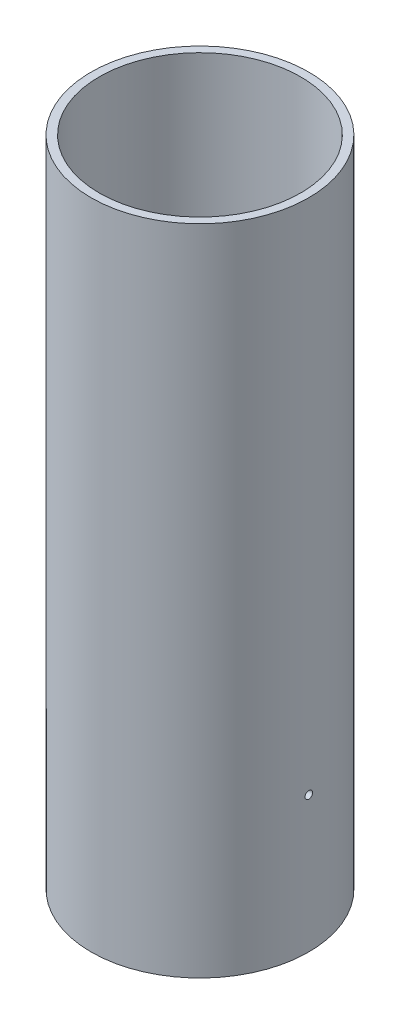
from build123d import *

# Parameters (mm, degrees)
SKETCH1_R               = 50.8
SKETCH1_R_2             = 46.99
BOSS_EXTRUDE1_DEPTH     = 304.8
CUT_EXTRUDE1_REACH      = 327.279
CUT_EXTRUDE1_END_RADIUS = 46.99
SKETCH2_R               = 1.7526
CIRPATTERN1_COUNT       = 2


with BuildPart() as part:
    # Sketch1 → Boss-Extrude1 (new body)
    with BuildSketch(Plane(origin=(0, 0, 0), x_dir=(1, 0, 0), z_dir=(0, 1, 0))):
        with Locations(Location((0, 0, 0), (0, 0, 90))):
            Circle(SKETCH1_R)
        with Locations(Location((0, 0, 0), (0, 0, 90))):
            Circle(SKETCH1_R_2, mode=Mode.SUBTRACT)
    extrude(amount=BOSS_EXTRUDE1_DEPTH)

    # Cut-Extrude1: up to this cylinder (the profile starts outside it)
    cut_extrude1_end = Plane(origin=(0, 63.5, 0), z_dir=(0, -1, 0)) * Cylinder(CUT_EXTRUDE1_END_RADIUS, 749.538, mode=Mode.PRIVATE)
    # Sketch2 → Cut-Extrude1 (cut, up to the surface)
    with BuildSketch(Plane(origin=(50.8, 0, 0), x_dir=(0, 0, -1), z_dir=(1, 0, 0)), mode=Mode.PRIVATE) as cut_extrude1_sk1:
        with Locations((0, 63.5)):
            Circle(SKETCH2_R)
    cut_extrude1_tool1 = extrude(cut_extrude1_sk1.sketch, amount=-CUT_EXTRUDE1_REACH, mode=Mode.PRIVATE) - cut_extrude1_end
    cut_extrude1 = cut_extrude1_tool1.solids().sort_by_distance((50.8, 63.5, 0))[0]
    add(cut_extrude1, mode=Mode.SUBTRACT)

    # CirPattern1: Cut-Extrude1 ×2 about axis
    cirpattern1_axis = Axis((0, 0, 0), (0, 1, 0))
    for i in range(1, CIRPATTERN1_COUNT):
        add(cut_extrude1.rotate(cirpattern1_axis, i * 360 / CIRPATTERN1_COUNT), mode=Mode.SUBTRACT)


solid = part.part
